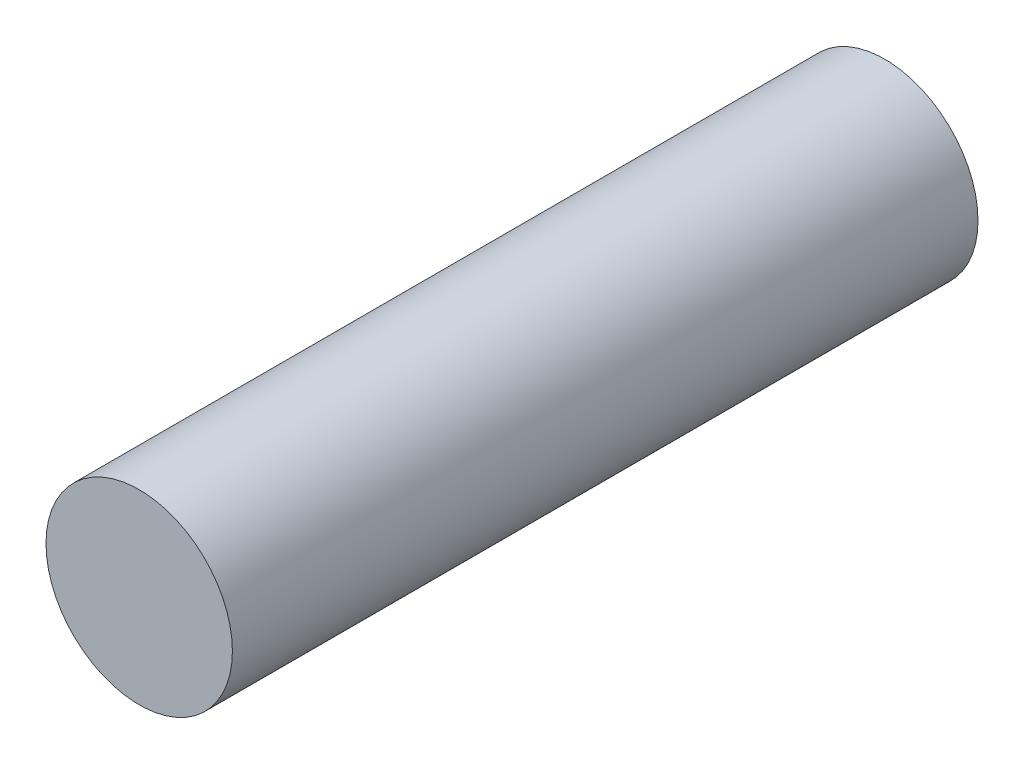
from build123d import *

# Parameters (mm, degrees)
SKETCH_1_R      = 1.75
EXTRUDE_1_DEPTH = 14


with BuildPart() as part:
    # 草图1 → 凸台-拉伸1 (new body)
    with BuildSketch(Plane.XY):
        Circle(SKETCH_1_R)
    extrude(amount=EXTRUDE_1_DEPTH)


solid = part.part
